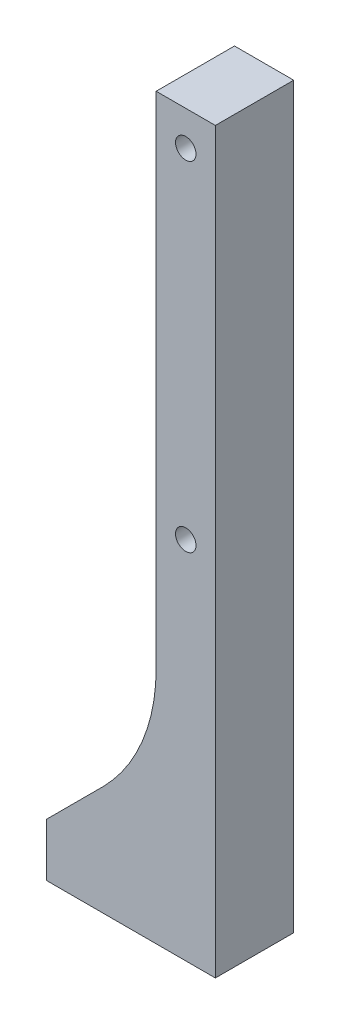
from build123d import *

# Parameters (mm, degrees)
SKETCH1_W           = 6.5
SKETCH1_H           = 6.5
SKETCH1_R           = 1.5
BOSS_EXTRUDE1_DEPTH = 5.8
SKETCH2_W           = 6.5
SKETCH2_H           = 5.8
BOSS_EXTRUDE2_DEPTH = 8.85
SKETCH6_W           = 8.85
SKETCH6_H           = 5.8
BOSS_EXTRUDE6_DEPTH = 12.06
SKETCH7_W           = 6.5
SKETCH7_H           = 8.85
BOSS_EXTRUDE7_DEPTH = 75.25
BOSS_EXTRUDE8_DEPTH = 8.85
FILLET3_R           = 20
SKETCH10_R          = 1.125
CUT_EXTRUDE1_DEPTH  = 84.899470201
CUT_EXTRUDE2_START  = -2
SKETCH11_R          = 1.125
CUT_EXTRUDE2_DEPTH  = 2
SKETCH13_W          = 12.06
SKETCH13_H          = 0.25
CUT_EXTRUDE4_DEPTH  = 84.36611182
SKETCH14_W          = 6.5
SKETCH14_H          = 0.25
CUT_EXTRUDE5_DEPTH  = 78.739105989


with BuildPart() as part:
    # Sketch1 → Boss-Extrude1 (new body)
    with BuildSketch(Plane(origin=(0, 0, 0), x_dir=(1, 0, 0), z_dir=(0, 1, 0))):
        Rectangle(SKETCH1_W, SKETCH1_H)
        with Locations(Location((0, 0, 0), (0, 0, 270))):
            Circle(SKETCH1_R, mode=Mode.SUBTRACT)
    extrude(amount=BOSS_EXTRUDE1_DEPTH)

    # Sketch2 → Boss-Extrude2 (add)
    with BuildSketch(Plane.XY.offset(3.25)):
        with Locations((0, 2.9)):
            Rectangle(SKETCH2_W, SKETCH2_H)
    extrude(amount=BOSS_EXTRUDE2_DEPTH)

    # Sketch6 → Boss-Extrude6 (add)
    with BuildSketch(Plane(origin=(3.25, 0, 0), x_dir=(0, 0, -1), z_dir=(1, 0, 0))):
        with Locations((-7.675, 2.9)):
            Rectangle(SKETCH6_W, SKETCH6_H)
    extrude(amount=BOSS_EXTRUDE6_DEPTH)

    # Sketch7 → Boss-Extrude7 (add)
    with BuildSketch(Plane(origin=(0, 5.8, 0), x_dir=(1, 0, 0), z_dir=(0, 1, 0))):
        with Locations((12.06, -7.675)):
            Rectangle(SKETCH7_W, SKETCH7_H)
    extrude(amount=BOSS_EXTRUDE7_DEPTH)

    # Sketch8 → Boss-Extrude8 (add)
    with BuildSketch(Plane.XY.offset(12.1)):
        Polygon((-3.25, 5.8), (8.81, 5.8), (8.81, 17.86), align=None)
    extrude(amount=-BOSS_EXTRUDE8_DEPTH)

    # Fillet3
    fillet3_edges = [part.edges().sort_by_distance(p)[0] for p in [
        (8.81, 17.86, 7.675),
    ]]
    fillet(fillet3_edges, radius=FILLET3_R)

    # Sketch10 → Cut-Extrude1 (cut, through all)
    with BuildSketch(Plane.XY.offset(12.1)):
        with Locations((12.06, 77.25)):
            Circle(SKETCH10_R)
        with Locations((12.06, 40.05)):
            Circle(SKETCH10_R)
    extrude(amount=-CUT_EXTRUDE1_DEPTH, mode=Mode.SUBTRACT)

    # Sketch11 → Cut-Extrude2 (cut)
    # profile 1 of 2: a face of its own
    with BuildSketch(Plane(origin=(0, 0, 3.25), x_dir=(-1, 0, 0), z_dir=(0, 0, -1)).offset(CUT_EXTRUDE2_START)):
        Polygon((-10.111442841, 76.125), (-10.111442841, 78.375), (-12.06, 79.5), (-14.008557159, 78.375), (-14.008557159, 76.125), (-12.06, 75), align=None)
        with Locations(Location((-12.06, 77.25, 0), (0, 0, 180))):
            Circle(SKETCH11_R, mode=Mode.SUBTRACT)
    # profile 2 of 2: a face of its own
    with BuildSketch(Plane(origin=(0, 0, 3.25), x_dir=(-1, 0, 0), z_dir=(0, 0, -1)).offset(CUT_EXTRUDE2_START)):
        Polygon((-10.111442841, 38.925), (-10.111442841, 41.175), (-12.06, 42.3), (-14.008557159, 41.175), (-14.008557159, 38.925), (-12.06, 37.8), align=None)
        with Locations(Location((-12.06, 40.05, 0), (0, 0, 180))):
            Circle(SKETCH11_R, mode=Mode.SUBTRACT)
    extrude(amount=CUT_EXTRUDE2_DEPTH, mode=Mode.SUBTRACT)

    # Sketch13 → Cut-Extrude4 (cut, through all)
    with BuildSketch(Plane(origin=(0, 0, 0), x_dir=(-1, 0, 0), z_dir=(0, -1, 0))):
        with Locations((-9.28, -3.375)):
            Rectangle(SKETCH13_W, SKETCH13_H)
    extrude(amount=-CUT_EXTRUDE4_DEPTH, mode=Mode.SUBTRACT)

    # Sketch14 → Cut-Extrude5 (cut, through all)
    with BuildSketch(Plane(origin=(0, 5.8, 0), x_dir=(1, 0, 0), z_dir=(0, 1, 0))):
        with Locations((0, -3.375)):
            Rectangle(SKETCH14_W, SKETCH14_H)
    extrude(amount=CUT_EXTRUDE5_DEPTH, mode=Mode.SUBTRACT)


solid = part.part
